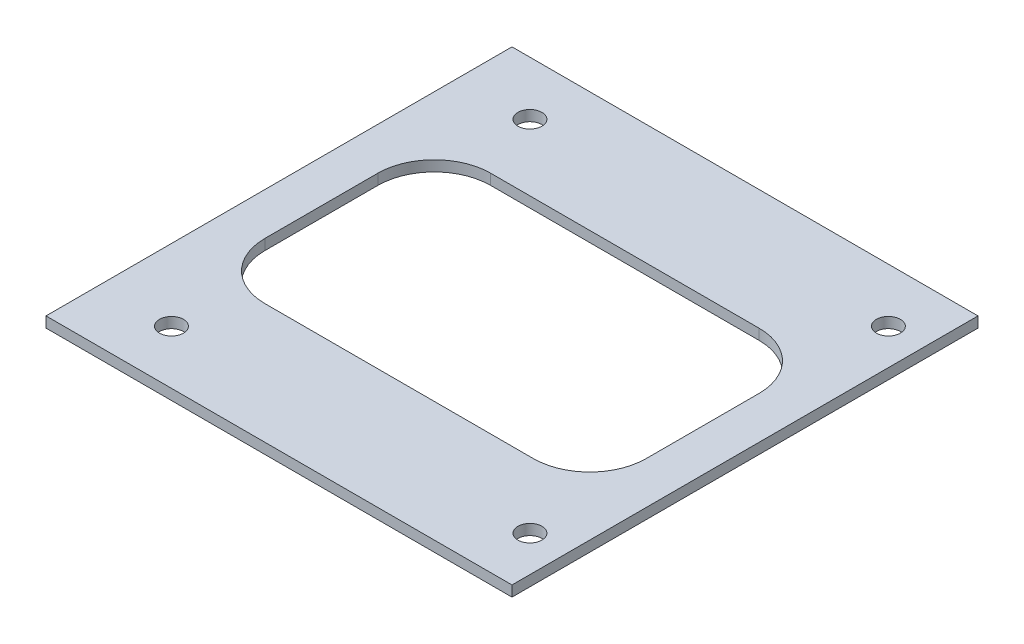
from build123d import *

# Parameters (mm, degrees)
SKETCH1_W           = 165.1
SKETCH1_H           = 165.1
BOSS_EXTRUDE1_DEPTH = 3.75
CUT_EXTRUDE1_REACH  = 118.804
SKETCH2_R           = 4.25
CUT_EXTRUDE2_REACH  = 118.804


with BuildPart() as part:
    # Sketch1 → Boss-Extrude1 (new body)
    with BuildSketch(Plane(origin=(0, 0, 0), x_dir=(1, 0, 0), z_dir=(0, 1, 0))):
        Rectangle(SKETCH1_W, SKETCH1_H)
    extrude(amount=BOSS_EXTRUDE1_DEPTH)

    # Sketch2 → Cut-Extrude1 (cut, up to next)
    with BuildSketch(Plane(origin=(0, 3.75, 0), x_dir=(1, 0, 0), z_dir=(0, 1, 0)), mode=Mode.PRIVATE) as cut_extrude1_sk1:
        with Locations(Location((69.85, 63.5, 0), (0, 0, 270))):
            Circle(SKETCH2_R)
    cut_extrude1_tool1 = extrude(cut_extrude1_sk1.sketch, amount=-CUT_EXTRUDE1_REACH, mode=Mode.PRIVATE) & part.part
    # Sketch2 → Cut-Extrude1 (cut, up to next)
    with BuildSketch(Plane(origin=(0, 3.75, 0), x_dir=(1, 0, 0), z_dir=(0, 1, 0)), mode=Mode.PRIVATE) as cut_extrude1_sk2:
        with Locations(Location((-57.15, 63.5, 0), (0, 0, 270))):
            Circle(SKETCH2_R)
    cut_extrude1_tool2 = extrude(cut_extrude1_sk2.sketch, amount=-CUT_EXTRUDE1_REACH, mode=Mode.PRIVATE) & part.part
    # Sketch2 → Cut-Extrude1 (cut, up to next)
    with BuildSketch(Plane(origin=(0, 3.75, 0), x_dir=(1, 0, 0), z_dir=(0, 1, 0)), mode=Mode.PRIVATE) as cut_extrude1_sk3:
        with Locations(Location((-57.15, -63.5, 0), (0, 0, 270))):
            Circle(SKETCH2_R)
    cut_extrude1_tool3 = extrude(cut_extrude1_sk3.sketch, amount=-CUT_EXTRUDE1_REACH, mode=Mode.PRIVATE) & part.part
    # Sketch2 → Cut-Extrude1 (cut, up to next)
    with BuildSketch(Plane(origin=(0, 3.75, 0), x_dir=(1, 0, 0), z_dir=(0, 1, 0)), mode=Mode.PRIVATE) as cut_extrude1_sk4:
        with Locations(Location((69.85, -63.5, 0), (0, 0, 270))):
            Circle(SKETCH2_R)
    cut_extrude1_tool4 = extrude(cut_extrude1_sk4.sketch, amount=-CUT_EXTRUDE1_REACH, mode=Mode.PRIVATE) & part.part
    add(cut_extrude1_tool1.solids().sort_by_distance((69.85, 3.75, -63.5))[0], mode=Mode.SUBTRACT)
    add(cut_extrude1_tool2.solids().sort_by_distance((-57.15, 3.75, -63.5))[0], mode=Mode.SUBTRACT)
    add(cut_extrude1_tool3.solids().sort_by_distance((-57.15, 3.75, 63.5))[0], mode=Mode.SUBTRACT)
    add(cut_extrude1_tool4.solids().sort_by_distance((69.85, 3.75, 63.5))[0], mode=Mode.SUBTRACT)

    # Sketch3 → Cut-Extrude2 (cut, up to next)
    with BuildSketch(Plane.XZ, mode=Mode.PRIVATE) as cut_extrude2_sk1:
        with BuildLine():
            Line((-67.55, -20), (-67.55, 20))
            ThreePointArc((-67.55, 20), (-61.692135624, 34.142135624), (-47.55, 40))
            Line((-47.55, 40), (47.55, 40))
            ThreePointArc((47.55, 40), (61.692135624, 34.142135624), (67.55, 20))
            Line((67.55, 20), (67.55, -20))
            ThreePointArc((67.55, -20), (61.692135624, -34.142135624), (47.55, -40))
            Line((47.55, -40), (-47.55, -40))
            ThreePointArc((-47.55, -40), (-61.692135624, -34.142135624), (-67.55, -20))
        make_face()
    cut_extrude2_tool1 = extrude(cut_extrude2_sk1.sketch, amount=-CUT_EXTRUDE2_REACH, mode=Mode.PRIVATE) & part.part
    add(cut_extrude2_tool1.solids().sort_by_distance((0, 0, 0))[0], mode=Mode.SUBTRACT)


solid = part.part
